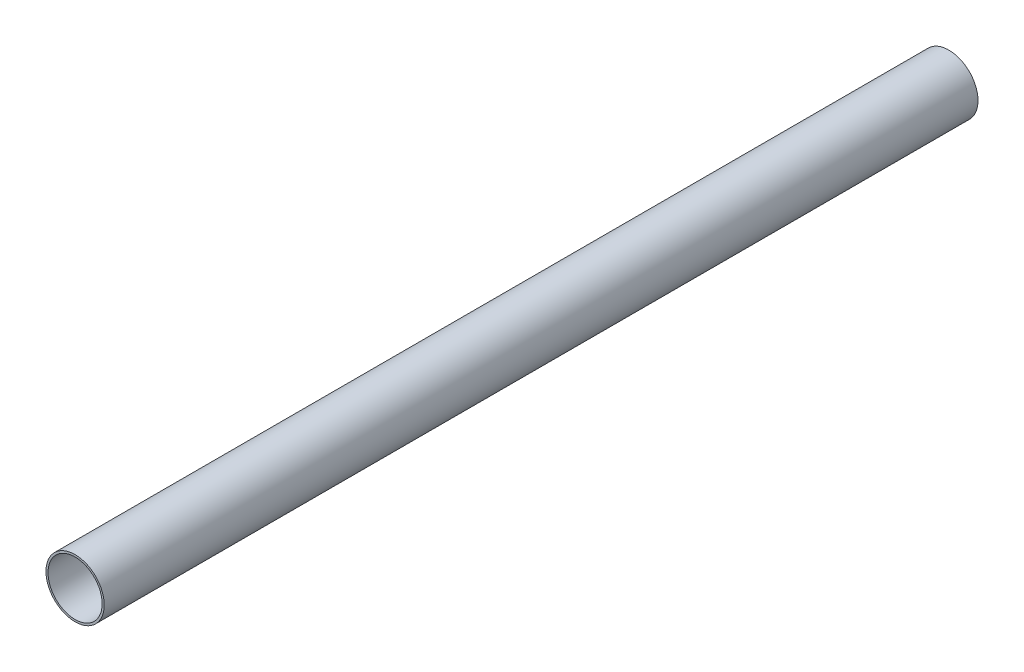
from build123d import *

# Parameters (mm, degrees)
SKETCH2_R           = 12.7
SKETCH2_R_2         = 11.811
BOSS_EXTRUDE1_DEPTH = 381


with BuildPart() as part:
    # Sketch2 → Boss-Extrude1 (new body)
    with BuildSketch(Plane.XY):
        Circle(SKETCH2_R)
        Circle(SKETCH2_R_2, mode=Mode.SUBTRACT)
    extrude(amount=BOSS_EXTRUDE1_DEPTH)


solid = part.part
